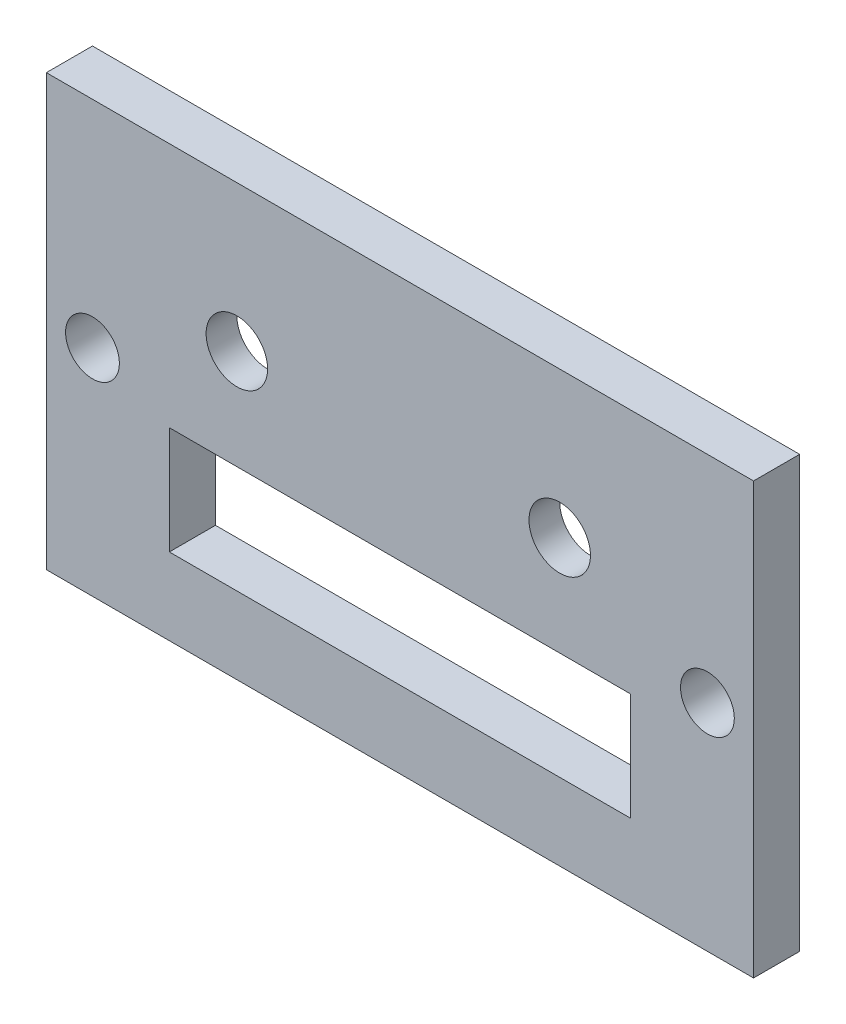
from build123d import *

# Parameters (mm, degrees)
CROQUIS1_W          = 30
CROQUIS1_H          = 11
CROQUIS1_R          = 2
UNION_IMU_DEPTH     = 2
CROQUIS2_R          = 1.75
UNION_CARCASA_DEPTH = 3


with BuildPart() as part:
    # Croquis1 → union-imu (new body)
    with BuildSketch(Plane.XY):
        with Locations((0, 0.5)):
            Rectangle(CROQUIS1_W, CROQUIS1_H)
        with Locations((-10.607695155, 1.5)):
            Circle(CROQUIS1_R, mode=Mode.SUBTRACT)
        with Locations((10.392304845, 1.5)):
            Circle(CROQUIS1_R, mode=Mode.SUBTRACT)
    extrude(amount=UNION_IMU_DEPTH)

    # Croquis2 → union-carcasa (add)
    with BuildSketch(Plane.XY.offset(2)):
        Polygon((-23, -17), (23, -17), (23, -4), (23, 11), (-23, 11), (-23, -4), align=None)
        with Locations((20, -3)):
            Circle(CROQUIS2_R, mode=Mode.SUBTRACT)
        with Locations((-20, -3)):
            Circle(CROQUIS2_R, mode=Mode.SUBTRACT)
        Polygon((15, -12), (15, -5), (15, 6), (-15, 6), (-15, -5), (-15, -12), align=None, mode=Mode.SUBTRACT)
    extrude(amount=-UNION_CARCASA_DEPTH)


solid = part.part
